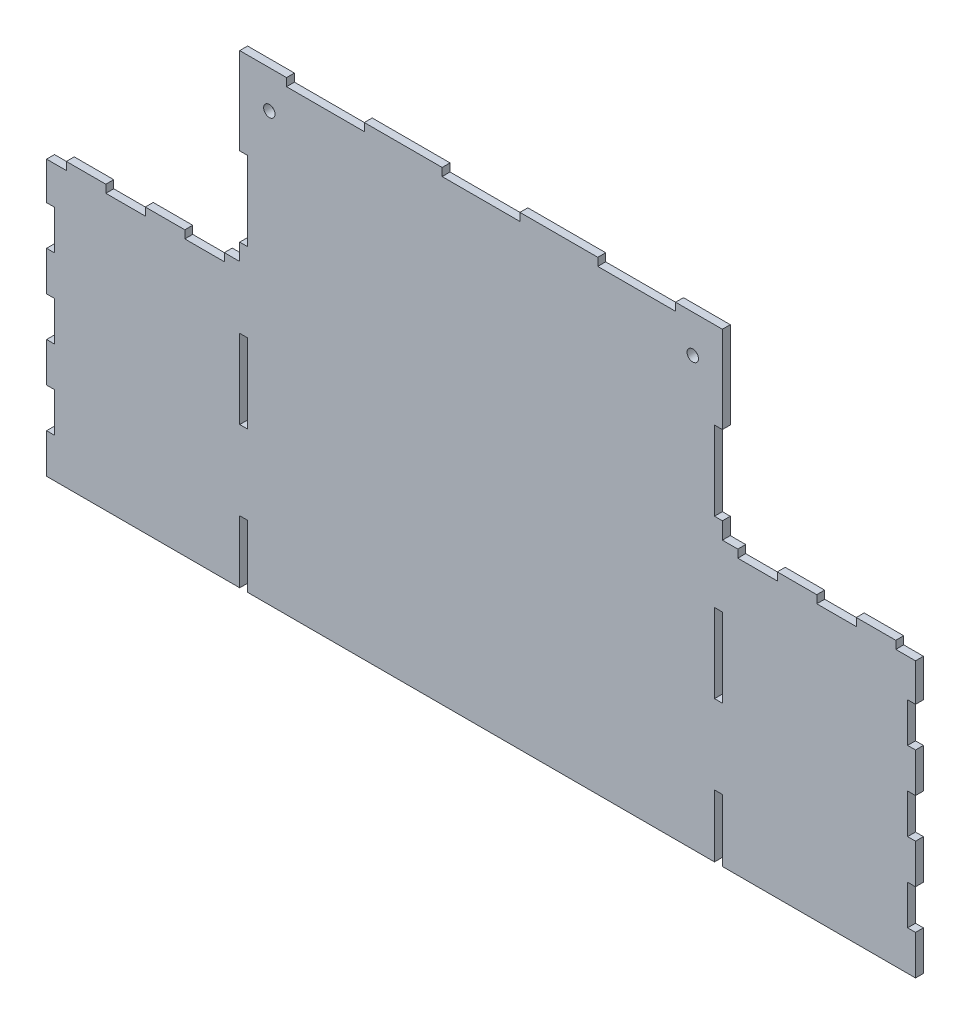
from build123d import *

# Parameters (mm, degrees)
SKETCH1_W                 = 155.194
SKETCH1_H                 = 149.606
BOSS_EXTRUDE1_DEPTH       = 2.54
SKETCH2_W                 = 62.103
SKETCH2_H                 = 90.8685
BOSS_EXTRUDE2_DEPTH       = 2.54
SKETCH3_W                 = 2.54
SKETCH3_H                 = 25.4
CUT_EXTRUDE1_DEPTH        = 159.486688428
LPATTERN1_COUNT           = 3
LPATTERN1_PITCH           = 50.8
MIRROR1_COPY_1_SKETCH_W   = 2.54
MIRROR1_COPY_1_SKETCH_H   = 25.4
MIRROR1_COPY_1_DEPTH      = 159.486688428
MIRROR1_COPY_2_SKETCH_W   = 2.54
MIRROR1_COPY_2_SKETCH_H   = 25.4
MIRROR1_COPY_2_DEPTH      = 159.486688428
SKETCH4_W                 = 12.7
SKETCH4_H                 = 2.54
CUT_EXTRUDE2_DEPTH        = 159.486688428
LPATTERN2_COUNT           = 3
LPATTERN2_PITCH           = 25.4
MIRROR2_COPY_1_SKETCH_W   = 12.7
MIRROR2_COPY_1_SKETCH_H   = 2.54
MIRROR2_COPY_1_DEPTH      = 159.486688428
MIRROR2_COPY_2_SKETCH_W   = 12.7
MIRROR2_COPY_2_SKETCH_H   = 2.54
MIRROR2_COPY_2_DEPTH      = 159.486688428
SKETCH5_W                 = 2.54
SKETCH5_H                 = 12.7
CUT_EXTRUDE3_DEPTH        = 2.54
LPATTERN3_COUNT           = 4
LPATTERN3_PITCH           = 25.4
MIRROR3_COPY_1_SKETCH_W   = 2.54
MIRROR3_COPY_1_SKETCH_H   = 12.7
MIRROR3_COPY_1_DEPTH      = 2.54
MIRROR3_COPY_2_SKETCH_W   = 2.54
MIRROR3_COPY_2_SKETCH_H   = 12.7
MIRROR3_COPY_2_DEPTH      = 2.54
MIRROR3_COPY_3_SKETCH_W   = 2.54
MIRROR3_COPY_3_SKETCH_H   = 12.7
MIRROR3_COPY_3_DEPTH      = 2.54
SKETCH6_W                 = 25.019
SKETCH6_H                 = 2.54
CUT_EXTRUDE4_DEPTH        = 2.54
LPATTERN4_COUNT           = 3
LPATTERN4_PITCH           = 50.038
F_6_CLEARANCE_HOLE1_D     = 3.6576
F_6_CLEARANCE_HOLE1_DEPTH = 9.398
F_6_CLEARANCE_HOLE1_TIP   = 1.0988539


with BuildPart() as part:
    # Sketch1 → Boss-Extrude1 (new body)
    with BuildSketch(Plane.XY):
        Rectangle(SKETCH1_W, SKETCH1_H)
    extrude(amount=BOSS_EXTRUDE1_DEPTH)

    # Sketch2 → Boss-Extrude2 (add)
    with BuildSketch(Plane.XY.offset(2.54)):
        with Locations((-108.6485, -29.36875)):
            Rectangle(SKETCH2_W, SKETCH2_H)
    boss_extrude2 = extrude(amount=-BOSS_EXTRUDE2_DEPTH)

    # Sketch3 → Cut-Extrude1 (cut, through all)
    with BuildSketch(Plane.XY.offset(2.54)):
        with Locations((-76.327, 34.163)):
            Rectangle(SKETCH3_W, SKETCH3_H)
    cut_extrude1 = extrude(amount=-CUT_EXTRUDE1_DEPTH, mode=Mode.SUBTRACT)

    # LPattern1: Cut-Extrude1 ×3
    with Locations(*[(0, -i * LPATTERN1_PITCH, 0) for i in range(1, LPATTERN1_COUNT)]):
        add(cut_extrude1, mode=Mode.SUBTRACT)

    # Mirror1: Boss-Extrude2, Cut-Extrude1 across plane
    add(boss_extrude2.mirror(Plane(origin=(0, 0, 0), x_dir=(0, 0, 1), z_dir=(1, 0, 0))))
    add(cut_extrude1.mirror(Plane(origin=(0, 0, 0), x_dir=(0, 0, 1), z_dir=(1, 0, 0))), mode=Mode.SUBTRACT)

    # Mirror1 copy 1 sketch → Mirror1 copy 1 (cut, through all)
    with BuildSketch(Plane(origin=(0, -50.8, 2.54), x_dir=(-1, 0, 0), z_dir=(0, 0, 1))):
        with Locations((-76.327, -34.163)):
            Rectangle(MIRROR1_COPY_1_SKETCH_W, MIRROR1_COPY_1_SKETCH_H)
    extrude(amount=-MIRROR1_COPY_1_DEPTH, mode=Mode.SUBTRACT)

    # Mirror1 copy 2 sketch → Mirror1 copy 2 (cut, through all)
    with BuildSketch(Plane(origin=(0, -101.6, 2.54), x_dir=(-1, 0, 0), z_dir=(0, 0, 1))):
        with Locations((-76.327, -34.163)):
            Rectangle(MIRROR1_COPY_2_SKETCH_W, MIRROR1_COPY_2_SKETCH_H)
    extrude(amount=-MIRROR1_COPY_2_DEPTH, mode=Mode.SUBTRACT)

    # Sketch4 → Cut-Extrude2 (cut, through all)
    with BuildSketch(Plane.XY.offset(2.54)):
        with Locations((-139.7, 14.7955)):
            Rectangle(SKETCH4_W, SKETCH4_H)
    cut_extrude2 = extrude(amount=-CUT_EXTRUDE2_DEPTH, mode=Mode.SUBTRACT)

    # LPattern2: Cut-Extrude2 ×3
    with Locations(*[(i * LPATTERN2_PITCH, 0, 0) for i in range(1, LPATTERN2_COUNT)]):
        add(cut_extrude2, mode=Mode.SUBTRACT)

    # Mirror2: Cut-Extrude2 across plane
    add(cut_extrude2.mirror(Plane(origin=(0, 0, 0), x_dir=(0, 0, 1), z_dir=(1, 0, 0))), mode=Mode.SUBTRACT)

    # Mirror2 copy 1 sketch → Mirror2 copy 1 (cut, through all)
    with BuildSketch(Plane(origin=(-25.4, 0, 2.54), x_dir=(-1, 0, 0), z_dir=(0, 0, 1))):
        with Locations((-139.7, -14.7955)):
            Rectangle(MIRROR2_COPY_1_SKETCH_W, MIRROR2_COPY_1_SKETCH_H)
    extrude(amount=-MIRROR2_COPY_1_DEPTH, mode=Mode.SUBTRACT)

    # Mirror2 copy 2 sketch → Mirror2 copy 2 (cut, through all)
    with BuildSketch(Plane(origin=(-50.8, 0, 2.54), x_dir=(-1, 0, 0), z_dir=(0, 0, 1))):
        with Locations((-139.7, -14.7955)):
            Rectangle(MIRROR2_COPY_2_SKETCH_W, MIRROR2_COPY_2_SKETCH_H)
    extrude(amount=-MIRROR2_COPY_2_DEPTH, mode=Mode.SUBTRACT)

    # Sketch5 → Cut-Extrude3 (cut)
    with BuildSketch(Plane.XY.offset(2.54)):
        with Locations((-138.43, -55.753)):
            Rectangle(SKETCH5_W, SKETCH5_H)
    cut_extrude3 = extrude(amount=-CUT_EXTRUDE3_DEPTH, mode=Mode.SUBTRACT)

    # LPattern3: Cut-Extrude3 ×4
    with Locations(*[(0, i * LPATTERN3_PITCH, 0) for i in range(1, LPATTERN3_COUNT)]):
        add(cut_extrude3, mode=Mode.SUBTRACT)

    # Mirror3: Cut-Extrude3 across plane
    add(cut_extrude3.mirror(Plane(origin=(0, 0, 0), x_dir=(0, 0, 1), z_dir=(1, 0, 0))), mode=Mode.SUBTRACT)

    # Mirror3 copy 1 sketch → Mirror3 copy 1 (cut)
    with BuildSketch(Plane(origin=(0, 25.4, 2.54), x_dir=(-1, 0, 0), z_dir=(0, 0, 1))):
        with Locations((-138.43, 55.753)):
            Rectangle(MIRROR3_COPY_1_SKETCH_W, MIRROR3_COPY_1_SKETCH_H)
    extrude(amount=-MIRROR3_COPY_1_DEPTH, mode=Mode.SUBTRACT)

    # Mirror3 copy 2 sketch → Mirror3 copy 2 (cut)
    with BuildSketch(Plane(origin=(0, 50.8, 2.54), x_dir=(-1, 0, 0), z_dir=(0, 0, 1))):
        with Locations((-138.43, 55.753)):
            Rectangle(MIRROR3_COPY_2_SKETCH_W, MIRROR3_COPY_2_SKETCH_H)
    extrude(amount=-MIRROR3_COPY_2_DEPTH, mode=Mode.SUBTRACT)

    # Mirror3 copy 3 sketch → Mirror3 copy 3 (cut)
    with BuildSketch(Plane(origin=(0, 76.2, 2.54), x_dir=(-1, 0, 0), z_dir=(0, 0, 1))):
        with Locations((-138.43, 55.753)):
            Rectangle(MIRROR3_COPY_3_SKETCH_W, MIRROR3_COPY_3_SKETCH_H)
    extrude(amount=-MIRROR3_COPY_3_DEPTH, mode=Mode.SUBTRACT)

    # Sketch6 → Cut-Extrude4 (cut)
    with BuildSketch(Plane.XY.offset(2.54)):
        with Locations((-50.038, 73.533)):
            Rectangle(SKETCH6_W, SKETCH6_H)
    cut_extrude4 = extrude(amount=-CUT_EXTRUDE4_DEPTH, mode=Mode.SUBTRACT)

    # LPattern4: Cut-Extrude4 ×3
    with Locations(*[(i * LPATTERN4_PITCH, 0, 0) for i in range(1, LPATTERN4_COUNT)]):
        add(cut_extrude4, mode=Mode.SUBTRACT)

    # #6 Clearance Hole1
    with Locations(Plane.XY.offset(2.54)):
        with Locations((-68.072, 62.738), (68.072, 62.738)):
            Hole(F_6_CLEARANCE_HOLE1_D / 2, depth=F_6_CLEARANCE_HOLE1_DEPTH)
            with Locations((0, 0, -(F_6_CLEARANCE_HOLE1_DEPTH + F_6_CLEARANCE_HOLE1_TIP / 2))):  # 118° drill point
                Cone(0, F_6_CLEARANCE_HOLE1_D / 2, F_6_CLEARANCE_HOLE1_TIP, mode=Mode.SUBTRACT)


solid = part.part
